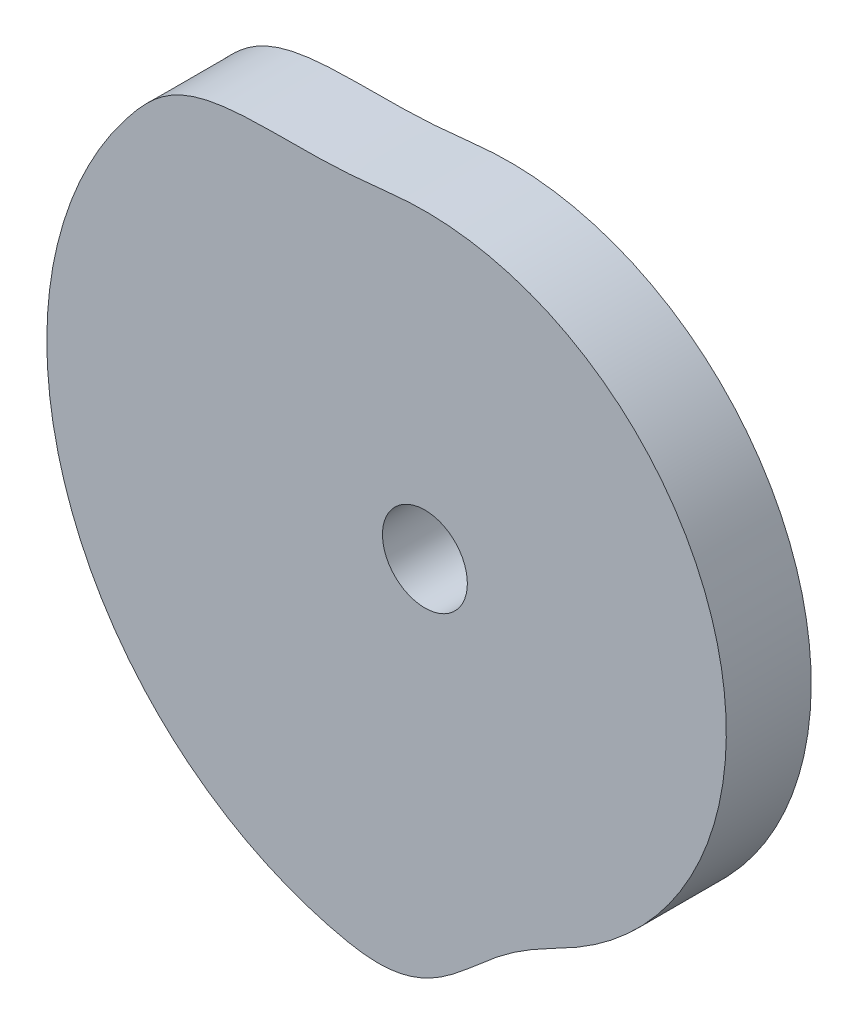
from build123d import *

# Parameters (mm, degrees)
SKETCH_1_R      = 10
EXTRUDE_1_DEPTH = 20


with BuildPart() as part:
    # 草图1 → 凸台-拉伸1 (new body)
    with BuildSketch(Plane.XY):
        with BuildLine():
            add(Edge.make_bspline(
                [(-55.6374, -69.5513), (-55.435080828, -69.713131145), (-55.028951697, -70.034935448), (-54.415838072, -70.512636921), (-53.798340634, -70.984682324), (-53.176905112, -71.451505301), (-52.551328233, -71.912829891), (-51.921793956, -72.36871256), (-51.288237835, -72.819018259), (-50.650855747, -73.263813604), (-50.009623737, -73.70306875), (-49.364512113, -74.136604417), (-48.715749224, -74.564699447), (-48.06307732, -74.986806665), (-47.406931847, -75.403480156), (-46.747074207, -75.814223134), (-46.083799829, -76.219409623), (-45.416859056, -76.618579027), (-44.746465622, -77.011932688), (-44.072789537, -77.399625783), (-43.39560685, -77.781146539), (-42.715282083, -78.157044427), (-42.031524058, -78.526643564), (-41.344720622, -78.890528245), (-40.654701476, -79.24829155), (-39.961608941, -79.600138689), (-39.26541289, -79.945778905), (-38.566303995, -80.285464915), (-37.864159903, -80.618766709), (-37.159269943, -80.946261841), (-36.451456934, -81.267433345), (-35.740855002, -81.582426101), (-35.027576029, -81.891239208), (-34.311600379, -82.193748657), (-33.593045444, -82.490040011), (-32.871917802, -82.780050756), (-32.148287875, -83.063754981), (-31.422209927, -83.341176081), (-30.693684538, -83.612136233), (-29.962877791, -83.876869452), (-29.229797312, -84.135188522), (-28.494427987, -84.386943365), (-27.756995336, -84.632470335), (-27.017407785, -84.87150398), (-26.275737967, -85.103988542), (-25.532018775, -85.329948724), (-24.786455262, -85.549596268), (-24.038951581, -85.762610454), (-23.289637268, -85.96904638), (-22.538540146, -86.169138789), (-21.786022407, -86.362394597), (-21.034031627, -86.548616823), (-20.286070083, -86.727063137), (-19.545333613, -86.895918979), (-18.813556882, -87.054294948), (-18.090942417, -87.20158721), (-17.377195196, -87.337152819), (-16.672144994, -87.460656266), (-15.975482538, -87.571464699), (-15.287039186, -87.669602439), (-14.606449649, -87.754320038), (-13.933457493, -87.825594005), (-13.267676997, -87.883044688), (-12.608778793, -87.926432757), (-11.956374957, -87.955802771), (-11.310118513, -87.970678026), (-10.66958643, -87.971069355), (-10.034347508, -87.95680664), (-9.404022559, -87.927942628), (-8.778211369, -87.883870275), (-8.156538098, -87.825063147), (-7.538603354, -87.750954136), (-6.92412725, -87.66145561), (-6.31268915, -87.55693425), (-5.704195456, -87.436579781), (-5.098235359, -87.300984132), (-4.494770387, -87.14955452), (-3.893489191, -86.982621027), (-3.294451035, -86.79976936), (-2.697433588, -86.601388762), (-2.102490702, -86.38731543), (-1.50969898, -86.157445582), (-0.918944855, -85.912258193), (-0.330326089, -85.651632188), (0.256047248, -85.375734464), (0.840159241, -85.084905807), (1.421859859, -84.779326385), (2.001316782, -84.459649855), (2.578043638, -84.125478924), (3.152531816, -83.778079451), (3.724326985, -83.417080268), (4.293838694, -83.043497382), (4.860951007, -82.657556666), (5.4259775, -82.259957296), (5.988876731, -81.850934498), (6.550016157, -81.431130067), (7.109904348, -81.001417257), (7.668471204, -80.561747602), (8.226671116, -80.113402469), (8.78452519, -79.656443439), (9.342803763, -79.191734587), (9.902130642, -78.719968429), (10.462896638, -78.241452335), (11.026049265, -77.757258287), (11.592013315, -77.267756662), (12.161731782, -76.774003391), (12.735606904, -76.276379151), (13.314598349, -75.776063449), (13.899008645, -75.273497526), (14.489709699, -74.769978658), (15.086924468, -74.266033928), (15.691336222, -73.763010479), (16.302951059, -73.26151457), (16.92211849, -72.762880323), (17.54879408, -72.268006871), (18.182886286, -71.777991873), (18.824065158, -71.293646024), (19.471967846, -70.815996871), (20.126048361, -70.34589943), (20.785613976, -69.884186013), (21.449770825, -69.431310994), (22.117757088, -68.987961972), (22.78863255, -68.554592266), (23.461295828, -68.13125211), (24.134646442, -67.718014926), (24.807828593, -67.315144874), (25.479619756, -66.922199531), (26.149074755, -66.538965241), (26.815298778, -66.165234547), (27.477059889, -65.800128243), (28.133755228, -65.443677183), (28.784243016, -65.09484379), (29.427829947, -64.753214852), (30.063631592, -64.418156375), (30.6908495, -64.08887356), (31.308764356, -63.764946392), (31.916542578, -63.445453623), (32.513605116, -63.130182178), (33.099193109, -62.818385164), (33.672564541, -62.509449077), (34.233448681, -62.202856527), (34.783124734, -61.897190724), (35.324464228, -61.589820876), (35.860940989, -61.279138564), (36.394274999, -60.963713732), (36.92494916, -60.643892915), (37.452799137, -60.319393455), (37.977673151, -59.99012133), (38.499771885, -59.656481099), (39.018883309, -59.318255069), (39.535049321, -58.975528186), (40.048184222, -58.628254744), (40.558297102, -58.276532871), (41.0653441, -57.920471592), (41.569104774, -57.5597961), (42.069851326, -57.194933456), (42.567366747, -56.825613441), (43.061612995, -56.451914599), (43.552668132, -56.074014553), (44.040335623, -55.691810743), (44.524696903, -55.305415567), (45.005540487, -54.914675623), (45.483099059, -54.519916522), (45.957076599, -54.120846993), (46.427694927, -53.717810351), (46.894668354, -53.310576957), (47.358126764, -52.899373908), (47.81790885, -52.484051792), (48.274092484, -52.064769354), (48.726636868, -51.641548951), (49.175426943, -51.21437168), (49.620403953, -50.78321379), (50.061759506, -50.348370904), (50.499141691, -49.909518782), (50.932723838, -49.466903209), (51.362577905, -49.020653083), (51.788352228, -48.570497304), (52.210245221, -48.11672364), (52.628186189, -47.659295637), (53.04207781, -47.1982189), (53.451860431, -46.733476253), (53.857672277, -46.265285416), (54.259434221, -45.793600897), (54.656834626, -45.31825925), (55.050335286, -44.839673013), (55.439504317, -44.357550139), (55.824492221, -43.872070754), (56.205256422, -43.383256313), (56.581547651, -42.891019048), (56.953891732, -42.395748197), (57.321592534, -41.897044366), (57.685020176, -41.395236109), (58.044060916, -40.890302517), (58.39864654, -40.382196891), (58.748807411, -39.87103165), (59.094581378, -39.356886265), (59.435763095, -38.839678661), (59.772422704, -38.319513243), (60.104613317, -37.796475345), (60.432003386, -37.270458984), (60.755119059, -36.741776511), (61.073355722, -36.210176572), (61.386996625, -35.675820658), (61.69596277, -35.138760103), (62.000304357, -34.599023224), (62.299867792, -34.056661141), (62.594717744, -33.511727566), (62.884678487, -32.964195914), (63.170012322, -32.41420479), (63.450503727, -31.861723819), (63.726120057, -31.306805031), (63.996814064, -30.749459624), (64.262695307, -30.189807664), (64.523731709, -29.627865234), (64.779809267, -29.063662664), (65.03103976, -28.497265214), (65.277234666, -27.928669832), (65.518384171, -27.357943097), (65.754799987, -26.785225879), (65.985900329, -26.210346252), (66.212151441, -25.633508318), (66.43332089, -25.054750932), (66.649490792, -24.474084441), (66.86038939, -23.891511096), (67.066510764, -23.307185709), (67.267213095, -22.721015206), (67.462972397, -22.133144211), (67.653567233, -21.543594591), (67.838935719, -20.95234998), (68.019292864, -20.359596005), (68.194250849, -19.765205745), (68.364166995, -19.16936257), (68.52885577, -18.572035236), (68.688400413, -17.973331201), (68.84254829, -17.373218143), (68.991601616, -16.771815293), (69.135249312, -16.169103977), (69.27379429, -15.565198091), (69.406973836, -14.960102457), (69.534897741, -14.353849997), (69.657478358, -13.746488485), (69.774775511, -13.13806431), (69.886813613, -12.528686217), (69.993343508, -11.918338755), (70.094815683, -11.307138438), (70.190809003, -10.695012468), (70.281373784, -10.082045223), (70.366679323, -9.468322886), (70.446698698, -8.853939406), (70.521309216, -8.2388499), (70.5905037, -7.623125023), (70.654260727, -7.006794064), (70.712844779, -6.389984321), (70.765759085, -5.772680643), (70.813515629, -5.15493123), (70.855794589, -4.536772496), (70.892701647, -3.918249369), (70.924197237, -3.299458859), (70.95030522, -2.680402189), (70.970988976, -2.06114493), (70.986335986, -1.441722713), (70.996065752, -0.822230228), (71.000599511, -0.202674791), (70.999736623, 0.416916528), (70.993253589, 1.036504853), (70.981650126, 1.655998297), (70.964349298, 2.275350526), (70.941947835, 2.894546724), (70.913858286, 3.51349677), (70.880632358, 4.132194343), (70.841799188, 4.75054809), (70.797574182, 5.36856688), (70.748103138, 5.986195128), (70.693204957, 6.60335261), (70.632894384, 7.22000869), (70.567208346, 7.836100906), (70.496069113, 8.451615996), (70.41970566, 9.066514764), (70.337910735, 9.680706665), (70.250670537, 10.294119785), (70.158210638, 10.906788278), (70.060246126, 11.518590547), (69.957248886, 12.12958236), (69.848548136, 12.739537947), (69.734769747, 13.348604143), (69.615734164, 13.956648347), (69.491133292, 14.563604694), (69.36150106, 15.169483163), (69.22647582, 15.77420214), (69.086197886, 16.377698523), (68.940548564, 16.979936139), (68.789772861, 17.580899135), (68.633785032, 18.180569188), (68.47244131, 18.778796795), (68.306101176, 19.375656514), (68.134358643, 19.97096006), (67.957453732, 20.564739424), (67.775449356, 21.157006013), (67.588275106, 21.747672659), (67.395867355, 22.336651174), (67.198320286, 22.923926417), (66.995774169, 23.509469847), (66.78804493, 24.093218227), (66.575233108, 24.675093033), (66.357449617, 25.255136838), (66.134531692, 25.833255606), (65.906557091, 26.409411551), (65.673516963, 26.983506681), (65.435639973, 27.555602891), (65.192620522, 28.125525454), (64.944719759, 28.693398493), (64.69182725, 29.259046236), (64.434035013, 29.822476025), (64.171262437, 30.383584924), (63.903851437, 30.942518913), (63.631319748, 31.498964968), (63.353964394, 32.053029405), (63.071934513, 32.604691668), (62.784988586, 33.153828075), (62.493281771, 33.70045108), (62.196808829, 34.244508006), (61.895575108, 34.785949589), (61.58965165, 35.324762651), (61.279137826, 35.860940601), (60.96371393, 36.394275103), (60.643892862, 36.924949132), (60.319393469, 37.452799144), (59.990121326, 37.977673149), (59.6564811, 38.499771886), (59.318255069, 39.018883308), (58.975528186, 39.535049321), (58.628254744, 40.048184222), (58.276532871, 40.558297102), (57.920471592, 41.0653441), (57.5597961, 41.569104774), (57.194933456, 42.069851326), (56.825613441, 42.567366747), (56.451914599, 43.061612995), (56.074014553, 43.552668132), (55.691810743, 44.040335623), (55.305415567, 44.524696903), (54.914675623, 45.005540487), (54.519916522, 45.483099059), (54.120846993, 45.957076599), (53.717810351, 46.427694927), (53.310576957, 46.894668354), (52.899373908, 47.358126764), (52.484051792, 47.81790885), (52.064769354, 48.274092484), (51.641548951, 48.726636868), (51.21437168, 49.175426943), (50.78321379, 49.620403953), (50.348370904, 50.061759506), (49.909518782, 50.499141691), (49.466903209, 50.932723838), (49.020653083, 51.362577905), (48.570497304, 51.788352228), (48.11672364, 52.210245221), (47.659295637, 52.628186189), (47.1982189, 53.04207781), (46.733476253, 53.451860431), (46.265285416, 53.857672277), (45.793600897, 54.259434221), (45.31825925, 54.656834626), (44.839673013, 55.050335286), (44.357550139, 55.439504317), (43.872070754, 55.824492221), (43.383256313, 56.205256422), (42.891019048, 56.581547651), (42.395748197, 56.953891732), (41.897044366, 57.321592534), (41.395236109, 57.685020176), (40.890302517, 58.044060916), (40.382196891, 58.39864654), (39.87103165, 58.748807411), (39.356886265, 59.094581378), (38.839678661, 59.435763095), (38.319513243, 59.772422704), (37.796475345, 60.104613317), (37.270458984, 60.432003386), (36.741776511, 60.755119059), (36.210176572, 61.073355722), (35.675820658, 61.386996625), (35.138760103, 61.69596277), (34.599023224, 62.000304357), (34.056661141, 62.299867792), (33.511727566, 62.594717744), (32.964195914, 62.884678487), (32.41420479, 63.170012322), (31.861723819, 63.450503727), (31.306805031, 63.726120057), (30.749459624, 63.996814064), (30.189807664, 64.262695307), (29.627865234, 64.523731709), (29.063662664, 64.779809267), (28.497265214, 65.03103976), (27.928669832, 65.277234666), (27.357943097, 65.518384171), (26.785225879, 65.754799987), (26.210346252, 65.985900329), (25.633508318, 66.212151441), (25.054750932, 66.43332089), (24.474084441, 66.649490792), (23.891511096, 66.86038939), (23.307185709, 67.066510764), (22.721015206, 67.267213095), (22.133144211, 67.462972397), (21.543594591, 67.653567233), (20.95234998, 67.838935719), (20.359596005, 68.019292864), (19.765205745, 68.194250849), (19.16936257, 68.364166995), (18.572035236, 68.52885577), (17.973331201, 68.688400413), (17.373218143, 68.84254829), (16.771815293, 68.991601616), (16.169103977, 69.135249312), (15.565198091, 69.27379429), (14.960102457, 69.406973836), (14.353849997, 69.534897741), (13.746488485, 69.657478358), (13.13806431, 69.774775511), (12.528686217, 69.886813613), (11.918338755, 69.993343508), (11.307138438, 70.094815683), (10.695012468, 70.190809003), (10.082045223, 70.281373784), (9.468322886, 70.366679323), (8.853939406, 70.446698698), (8.2388499, 70.521309216), (7.623125023, 70.5905037), (7.006794064, 70.654260727), (6.389984321, 70.712844779), (5.772680643, 70.765759085), (5.15493123, 70.813515629), (4.536772496, 70.855794589), (3.918249369, 70.892701647), (3.299458859, 70.924197237), (2.680402189, 70.95030522), (2.06114493, 70.970988976), (1.441722713, 70.986335985), (0.822230228, 70.996065752), (0.202674791, 71.00059951), (-0.416916529, 70.999736627), (-1.036504852, 70.993253573), (-1.655998301, 70.981650182), (-2.27535051, 70.964349088), (-2.894546783, 70.941948616), (-3.51349655, 70.91385537), (-4.132195163, 70.880643238), (-4.750910046, 70.841735619), (-5.371875796, 70.797489263), (-5.999055706, 70.746982258), (-6.636654657, 70.691204316), (-7.286980862, 70.629961419), (-7.950582265, 70.564418027), (-8.627529763, 70.49526392), (-9.317739036, 70.422736308), (-10.021212056, 70.34818045), (-10.737736142, 70.271944989), (-11.46713869, 70.194981825), (-12.209091858, 70.117811146), (-12.963352857, 70.041656934), (-13.729444764, 69.966481553), (-14.507009609, 69.89361791), (-15.295557956, 69.823112377), (-16.094631541, 69.755869593), (-16.903719058, 69.69185695), (-17.722298276, 69.632000095), (-18.549845437, 69.576333367), (-19.38581851, 69.524900788), (-20.229733022, 69.478114255), (-21.081088994, 69.436117961), (-21.939332879, 69.39848013), (-22.803987407, 69.365598715), (-23.674533412, 69.336913184), (-24.550447255, 69.312467805), (-25.431261069, 69.292052611), (-26.316472091, 69.275243605), (-27.205579631, 69.261574168), (-28.098021118, 69.250925136), (-28.993224779, 69.242436089), (-29.890662294, 69.236075535), (-30.789764278, 69.231029509), (-31.689933003, 69.22698976), (-32.590500313, 69.223006105), (-33.49080266, 69.218989662), (-34.390138259, 69.213849536), (-35.287808832, 69.207245514), (-36.183050378, 69.198629894), (-37.075091087, 69.186943751), (-37.963174897, 69.172171557), (-38.846458633, 69.153038538), (-39.724149704, 69.12928124), (-40.595379999, 69.100205154), (-41.459388173, 69.065280053), (-42.315300077, 69.023707702), (-43.162321321, 68.975053279), (-43.999652121, 68.918798779), (-44.826530383, 68.854480857), (-45.642245334, 68.781504426), (-46.446086014, 68.699622571), (-47.237415992, 68.608126243), (-48.015668728, 68.50699407), (-48.780334218, 68.395851185), (-49.530952035, 68.27442935), (-50.267158361, 68.142326821), (-50.988745345, 67.999543201), (-51.695560853, 67.845992856), (-52.387499289, 67.681365432), (-53.064597831, 67.505610716), (-53.727049178, 67.318831665), (-54.375004036, 67.120570481), (-55.00888324, 66.911133373), (-55.62908618, 66.69014564), (-56.236166681, 66.457725482), (-56.830640852, 66.213520467), (-57.413231868, 65.957480279), (-57.984588883, 65.689328235), (-58.545512113, 65.408975185), (-59.09665807, 65.116034785), (-59.638857693, 64.810281924), (-60.172952057, 64.491499044), (-60.699446262, 64.159059784), (-61.219375085, 63.813125506), (-61.733128414, 63.45292117), (-62.241507097, 63.078339056), (-62.745063348, 62.68904047), (-63.244358047, 62.284718697), (-63.740024101, 61.865299423), (-64.232383673, 61.430373174), (-64.721929121, 60.979954807), (-65.209162856, 60.513944848), (-65.69447749, 60.032335736), (-66.178287641, 59.53514113), (-66.660899373, 59.022403652), (-67.142732045, 58.494283649), (-67.624373218, 57.95118063), (-68.106030203, 57.393186048), (-68.588102516, 56.820638867), (-69.071000771, 56.234231999), (-69.554025803, 55.635939892), (-70.035116247, 55.028703292), (-70.512639051, 54.415839723), (-70.984681753, 53.798340191), (-71.451505454, 53.17690523), (-71.91282985, 52.551328201), (-72.36871257, 51.921793964), (-72.819018256, 51.288237833), (-73.263813605, 50.650855747), (-73.70306875, 50.009623737), (-74.136604417, 49.364512113), (-74.564699447, 48.715749224), (-74.986806665, 48.06307732), (-75.403480156, 47.406931847), (-75.814223134, 46.747074207), (-76.219409623, 46.083799829), (-76.618579027, 45.416859056), (-77.011932688, 44.746465622), (-77.399625783, 44.072789537), (-77.781146539, 43.39560685), (-78.157044427, 42.715282083), (-78.526643564, 42.031524058), (-78.890528245, 41.344720622), (-79.24829155, 40.654701476), (-79.600138689, 39.961608941), (-79.945778905, 39.26541289), (-80.285464915, 38.566303995), (-80.618766709, 37.864159903), (-80.946261841, 37.159269943), (-81.267433345, 36.451456934), (-81.582426101, 35.740855002), (-81.891239208, 35.027576029), (-82.193748657, 34.311600379), (-82.490040011, 33.593045444), (-82.780050756, 32.871917802), (-83.063754981, 32.148287875), (-83.341176081, 31.422209927), (-83.612136233, 30.693684538), (-83.876869452, 29.962877791), (-84.135188522, 29.229797312), (-84.386943365, 28.494427987), (-84.632470335, 27.756995336), (-84.87150398, 27.017407785), (-85.103988544, 26.275737967), (-85.329948716, 25.532018773), (-85.549596299, 24.78645527), (-85.762610337, 24.038951551), (-85.969046815, 23.289637381), (-86.169137165, 22.538539725), (-86.36247708, 21.785726403), (-86.549286632, 21.031224124), (-86.729623002, 20.275184754), (-86.903197326, 19.517540305), (-87.070190246, 18.758442371), (-87.230633567, 17.997927907), (-87.38428205, 17.236014035), (-87.53144103, 16.47280162), (-87.671765411, 15.708318594), (-87.80566853, 14.942684642), (-87.932574209, 14.175861039), (-88.053048334, 13.407986889), (-88.166623927, 12.639047373), (-88.273463352, 11.869172538), (-88.373903153, 11.098406539), (-88.467156007, 10.326746507), (-88.554057994, 9.554336452), (-88.634002206, 8.781197094), (-88.707339834, 8.007407755), (-88.77383512, 7.233010304), (-88.833511996, 6.458043162), (-88.886531521, 5.68261744), (-88.932746912, 4.90672142), (-88.972094002, 4.130454623), (-89.004877147, 3.353864255), (-89.030592075, 2.577029363), (-89.049754839, 1.800002456), (-89.061991166, 1.02283835), (-89.067678702, 0.245609644), (-89.066293632, -0.531653367), (-89.058345163, -1.308883246), (-89.043528925, -2.08601289), (-89.021941826, -2.8629431), (-88.993501834, -3.639669679), (-88.95844451, -4.416135773), (-88.916524516, -5.192297972), (-88.867848368, -5.968029485), (-88.812299753, -6.743319823), (-88.750137499, -7.518088107), (-88.681153953, -8.292286998), (-88.605258777, -9.065833181), (-88.52299641, -9.838721906), (-88.433561748, -10.610824862), (-88.33776106, -11.382141359), (-88.234996084, -12.152592091), (-88.125622389, -12.922125097), (-88.009545212, -13.690697678), (-87.886582702, -14.458173559), (-87.757128245, -15.224582997), (-87.62091858, -15.989811911), (-87.477992352, -16.753797183), (-87.328523368, -17.516539896), (-87.172297761, -18.277924928), (-87.009487288, -19.037952296), (-86.840138014, -19.796535176), (-86.663989456, -20.553580516), (-86.481274978, -21.309065315), (-86.292105808, -22.062978263), (-86.096313006, -22.815178056), (-85.893865674, -23.565620282), (-85.684983747, -24.314288627), (-85.469632065, -25.061110594), (-85.247521128, -25.805955022), (-85.019206975, -26.548921867), (-84.784285679, -27.289847027), (-84.542860198, -28.02865889), (-84.295060649, -28.765356302), (-84.040908415, -29.499883224), (-83.780112825, -30.232090103), (-83.513190256, -30.962095023), (-83.239739089, -31.689695203), (-82.960061857, -32.414901955), (-82.674041308, -33.137625655), (-82.38175845, -33.857831404), (-82.083141329, -34.575409139), (-81.778337083, -35.290387143), (-81.467215322, -36.002662031), (-81.149964287, -36.712249924), (-80.826402594, -37.418972421), (-80.49681718, -38.122877749), (-80.161122464, -38.823929484), (-79.819217359, -39.521960777), (-79.47130273, -40.217036345), (-79.117320389, -40.908995184), (-78.75728727, -41.597844592), (-78.391279748, -42.283522372), (-78.019401158, -42.966052337), (-77.641518166, -43.645263682), (-77.257548299, -44.321053534), (-76.86786525, -44.993562891), (-76.472388887, -45.662698011), (-76.070951958, -46.328290603), (-75.663790147, -46.990361574), (-75.250824119, -47.648842715), (-74.832158484, -48.303711861), (-74.407755222, -48.95488993), (-73.97772889, -49.602363562), (-73.542037385, -50.245992836), (-73.100831284, -50.885904409), (-72.653887165, -51.521805292), (-72.201680353, -52.153989817), (-71.743652006, -52.781951261), (-71.280435882, -53.40610794), (-70.811578665, -54.026051679), (-70.337510543, -54.642005326), (-69.857982735, -55.253722172), (-69.373096442, -55.861184659), (-68.882937777, -56.464407249), (-68.38769602, -57.063454963), (-67.88705369, -57.658002444), (-67.381348655, -58.248265164), (-66.870455208, -58.834048416), (-66.35443314, -59.415338384), (-65.833448062, -59.992158084), (-65.307423282, -60.564375769), (-64.776435869, -61.131963626), (-64.240514245, -61.694883945), (-63.699698123, -62.253109746), (-63.153976363, -62.806596581), (-62.603519775, -63.355381341), (-62.048293166, -63.899331214), (-61.48827702, -64.438323211), (-60.923560259, -64.97241272), (-60.354272078, -65.501635206), (-59.780381042, -66.025819349), (-59.20192766, -66.544974979), (-58.618943006, -67.059027711), (-58.031561493, -67.56806101), (-57.439692271, -68.071858238), (-56.843549601, -68.570607054), (-56.242888402, -69.063931088), (-55.839723128, -69.38946569), (-55.6374, -69.5513)],
                knots=[0, 0, 0, 0, 0.001544721, 0.003089465, 0.004634138, 0.006178944, 0.0077236, 0.009268503, 0.010813217, 0.012357973, 0.013902611, 0.015447415, 0.01699217, 0.018536944, 0.020081736, 0.02162645, 0.023171138, 0.024715882, 0.026260732, 0.027805462, 0.029350164, 0.030894976, 0.032439729, 0.033984382, 0.035529131, 0.037073919, 0.038618774, 0.040163457, 0.04170818, 0.043252871, 0.044797658, 0.04634248, 0.047887273, 0.049431892, 0.050976717, 0.052521421, 0.054066122, 0.055610937, 0.057155728, 0.058700496, 0.060245288, 0.061789972, 0.063334793, 0.064879364, 0.066424183, 0.06796899, 0.069513769, 0.071058333, 0.072603238, 0.074147835, 0.075692765, 0.077235546, 0.078766847, 0.08027747, 0.081765288, 0.083230875, 0.084674423, 0.086096843, 0.087498477, 0.088880207, 0.090242881, 0.091587483, 0.092915024, 0.094226983, 0.095524298, 0.096808527, 0.098080893, 0.099343045, 0.100596663, 0.101842686, 0.103083223, 0.104319476, 0.10555303, 0.106785224, 0.108017567, 0.109250969, 0.110487129, 0.111726789, 0.112971225, 0.114221098, 0.115477416, 0.116740746, 0.118011599, 0.119290678, 0.120578586, 0.121875102, 0.123180849, 0.124496043, 0.125820627, 0.12715477, 0.128498683, 0.129852241, 0.131215576, 0.132588545, 0.133971456, 0.135364103, 0.136766812, 0.138179466, 0.139602347, 0.141035559, 0.142478972, 0.14393325, 0.145398284, 0.146874288, 0.148361405, 0.149859805, 0.151369329, 0.152890289, 0.154422254, 0.155965003, 0.157518143, 0.159081359, 0.160653457, 0.162233896, 0.163821282, 0.165414387, 0.167011829, 0.168612258, 0.170213601, 0.171814316, 0.173412498, 0.175006408, 0.176594359, 0.178174366, 0.179745126, 0.181304765, 0.182851886, 0.184385393, 0.185903982, 0.187406424, 0.188891688, 0.190359015, 0.191807331, 0.193236077, 0.194644062, 0.196031054, 0.197395848, 0.198738029, 0.200056761, 0.201351399, 0.202621309, 0.203867931, 0.205101363, 0.206332913, 0.207564206, 0.20879575, 0.210027124, 0.211258529, 0.212490017, 0.213721345, 0.214952606, 0.21618417, 0.217415579, 0.218646926, 0.219878258, 0.221109599, 0.222340999, 0.223572551, 0.224803951, 0.226035414, 0.227266753, 0.228498189, 0.229729563, 0.230960943, 0.232192447, 0.233423866, 0.234655163, 0.235886565, 0.237118031, 0.238349376, 0.239580827, 0.2408122, 0.242043591, 0.243274951, 0.244506374, 0.24573781, 0.246969221, 0.248200693, 0.249432038, 0.250663498, 0.251894886, 0.25312628, 0.254357639, 0.255589082, 0.256820374, 0.258051786, 0.25928326, 0.26051461, 0.261746088, 0.262977433, 0.264208976, 0.265440334, 0.266671599, 0.267903027, 0.269134549, 0.270365818, 0.271597257, 0.272828794, 0.274060082, 0.275291551, 0.276522893, 0.277754331, 0.278985623, 0.280217132, 0.281448509, 0.282680019, 0.283911313, 0.28514266, 0.286374071, 0.287605547, 0.288836915, 0.290068271, 0.291299796, 0.292531137, 0.293762569, 0.294994003, 0.296225453, 0.297456831, 0.298688125, 0.299919644, 0.301151005, 0.302382484, 0.303613734, 0.304845222, 0.306076547, 0.307308046, 0.308539315, 0.309770823, 0.311002225, 0.312233674, 0.313464959, 0.314696477, 0.315927884, 0.317159272, 0.318390686, 0.319622076, 0.320853488, 0.32208487, 0.323316268, 0.324547584, 0.325779106, 0.32701054, 0.328241977, 0.329473281, 0.330704614, 0.331936003, 0.333167545, 0.334398968, 0.335630365, 0.336861606, 0.338093181, 0.339324592, 0.340555953, 0.341787319, 0.343018622, 0.344250136, 0.34548156, 0.346712986, 0.347944311, 0.349175826, 0.350407228, 0.351638607, 0.352869865, 0.35410129, 0.35533278, 0.356564225, 0.357795527, 0.359026968, 0.360258458, 0.361489674, 0.36272113, 0.363952512, 0.365183897, 0.366415394, 0.367646702, 0.368878112, 0.370109522, 0.371341002, 0.372572472, 0.373803831, 0.375035144, 0.376266731, 0.377498034, 0.378729441, 0.379960749, 0.381192279, 0.38242358, 0.383655057, 0.384886454, 0.386117865, 0.387349193, 0.388580677, 0.389812024, 0.39104357, 0.392274922, 0.39350628, 0.394737685, 0.395968982, 0.397200512, 0.398431991, 0.399663264, 0.4008948, 0.40212613, 0.403357533, 0.404588849, 0.405820241, 0.407051803, 0.408283188, 0.409514414, 0.41074591, 0.411977249, 0.413208786, 0.414440172, 0.4156715, 0.416902958, 0.418134454, 0.419365729, 0.420597231, 0.421828524, 0.423059878, 0.424291387, 0.425522701, 0.426754086, 0.427985636, 0.42921693, 0.430448473, 0.431679848, 0.432911253, 0.434142741, 0.435374069, 0.43660533, 0.437836894, 0.439068303, 0.44029965, 0.441530982, 0.442762323, 0.443993722, 0.445225275, 0.446456675, 0.447688137, 0.448919477, 0.450150912, 0.451382287, 0.452613667, 0.453845171, 0.45507659, 0.456307887, 0.457539288, 0.458770755, 0.460002099, 0.461233551, 0.462464924, 0.463696315, 0.464927675, 0.466159098, 0.467390534, 0.468621944, 0.469853416, 0.471084762, 0.472316222, 0.47354761, 0.474779003, 0.476010362, 0.477241806, 0.478473097, 0.47970451, 0.480935984, 0.482167334, 0.483398812, 0.484630157, 0.4858617, 0.487093058, 0.488324323, 0.489555751, 0.490787273, 0.492018542, 0.49324998, 0.494481518, 0.495712806, 0.496944275, 0.498175616, 0.499407055, 0.500638347, 0.501869856, 0.503101232, 0.504332743, 0.505564037, 0.506795384, 0.508026795, 0.509258271, 0.510489639, 0.511720995, 0.512952519, 0.514183861, 0.515415292, 0.516646726, 0.517878176, 0.519109555, 0.520340849, 0.521572368, 0.522803728, 0.524035208, 0.525266458, 0.526497945, 0.527729271, 0.52896077, 0.530192038, 0.531423546, 0.532654949, 0.533886398, 0.535117683, 0.536349201, 0.537580608, 0.538811996, 0.54004341, 0.5412748, 0.542506212, 0.543737593, 0.544968992, 0.546200308, 0.54743183, 0.548663263, 0.5498947, 0.551126005, 0.552357338, 0.553588727, 0.554820268, 0.556051692, 0.557283089, 0.55851433, 0.559745905, 0.560977316, 0.562208676, 0.563440043, 0.564671345, 0.56590286, 0.567134283, 0.56836571, 0.569597034, 0.57082855, 0.572059952, 0.573291331, 0.574522589, 0.575754014, 0.576985504, 0.578216948, 0.579448251, 0.580679692, 0.581911181, 0.583142398, 0.584373854, 0.585607416, 0.586854151, 0.588125383, 0.589423495, 0.590748757, 0.592101251, 0.593480692, 0.594886681, 0.596319094, 0.597776972, 0.599259776, 0.600766738, 0.602296998, 0.603849413, 0.605423147, 0.607017337, 0.608630588, 0.610262261, 0.611910994, 0.613575838, 0.615256021, 0.616950401, 0.618658064, 0.620378062, 0.622109474, 0.62385136, 0.625602579, 0.627362587, 0.629130236, 0.630904364, 0.632684007, 0.634467989, 0.636255331, 0.638044851, 0.639835163, 0.641624881, 0.643412821, 0.645197402, 0.646977249, 0.648750803, 0.650516507, 0.652273032, 0.654018461, 0.655751496, 0.657470466, 0.659174138, 0.660860696, 0.662528956, 0.664177766, 0.665805624, 0.667411843, 0.668995211, 0.670555091, 0.672090907, 0.673602136, 0.675088504, 0.676550304, 0.67798767, 0.679400822, 0.680790758, 0.682158263, 0.683504265, 0.684830565, 0.686138284, 0.687429507, 0.688706031, 0.689969782, 0.691223397, 0.692468804, 0.693708284, 0.694944468, 0.696179795, 0.697416456, 0.698656645, 0.699902905, 0.701157152, 0.702421382, 0.703697562, 0.70498749, 0.706292471, 0.707614223, 0.708953568, 0.710312121, 0.711690602, 0.713089687, 0.71451027, 0.715952896, 0.717417655, 0.718905137, 0.720415422, 0.721946859, 0.723489749, 0.725034493, 0.726579166, 0.728123972, 0.729668628, 0.731213531, 0.732758245, 0.734303001, 0.735847639, 0.737392443, 0.738937198, 0.740481972, 0.742026764, 0.743571478, 0.745116166, 0.74666091, 0.74820576, 0.74975049, 0.751295192, 0.752840004, 0.754384757, 0.75592941, 0.757474159, 0.759018947, 0.760563802, 0.762108485, 0.763653208, 0.765197899, 0.766742686, 0.768287508, 0.769832301, 0.77137692, 0.772921745, 0.774466449, 0.77601115, 0.777555965, 0.779100756, 0.780645524, 0.782190316, 0.783735, 0.785279821, 0.786824392, 0.788369211, 0.789914018, 0.791458797, 0.793003361, 0.794548266, 0.796092863, 0.797637793, 0.799182405, 0.80072725, 0.802271967, 0.803816717, 0.805361426, 0.806906168, 0.808450907, 0.809995723, 0.811540377, 0.813085114, 0.814629922, 0.816174661, 0.817719478, 0.819264122, 0.82080903, 0.822353799, 0.823898501, 0.825443275, 0.82698802, 0.828532659, 0.830077522, 0.831622117, 0.83316696, 0.834711781, 0.836256484, 0.837801199, 0.839346038, 0.840890725, 0.842435373, 0.8439803, 0.845525027, 0.847069673, 0.848614357, 0.850159188, 0.851703894, 0.853248793, 0.854793408, 0.856338238, 0.857883021, 0.859427677, 0.860972482, 0.862517221, 0.864061945, 0.865606621, 0.867151539, 0.868696226, 0.870241027, 0.8717858, 0.873330499, 0.874875243, 0.876419917, 0.877964676, 0.879509404, 0.881054217, 0.882598889, 0.884143688, 0.88568849, 0.887233268, 0.888777947, 0.890322786, 0.891867519, 0.893412128, 0.894956999, 0.896501736, 0.898046458, 0.899591222, 0.901135955, 0.902680654, 0.904225491, 0.905770277, 0.90731506, 0.908859772, 0.91040453, 0.911949268, 0.913493844, 0.915038637, 0.916583502, 0.918128196, 0.919672933, 0.921217651, 0.922762552, 0.924307223, 0.925852048, 0.927396701, 0.928941476, 0.930486219, 0.932030969, 0.933575673, 0.935120425, 0.936665167, 0.938209948, 0.939754784, 0.941299349, 0.942844205, 0.944389026, 0.945933656, 0.947478486, 0.949023083, 0.950567954, 0.95211271, 0.953657377, 0.955202161, 0.956746978, 0.958291706, 0.959836425, 0.961381256, 0.962925913, 0.964470665, 0.966015452, 0.967560134, 0.96910496, 0.970649767, 0.972194541, 0.973739249, 0.975284012, 0.976828665, 0.978373326, 0.979918114, 0.981463005, 0.983007695, 0.984552445, 0.986097231, 0.987642024, 0.989186807, 0.990731417, 0.992276252, 0.993821001, 0.995365649, 0.996910444, 0.998455248, 1, 1, 1, 1], degree=3))
        make_face()
        Circle(SKETCH_1_R, mode=Mode.SUBTRACT)
    extrude(amount=EXTRUDE_1_DEPTH)


solid = part.part
